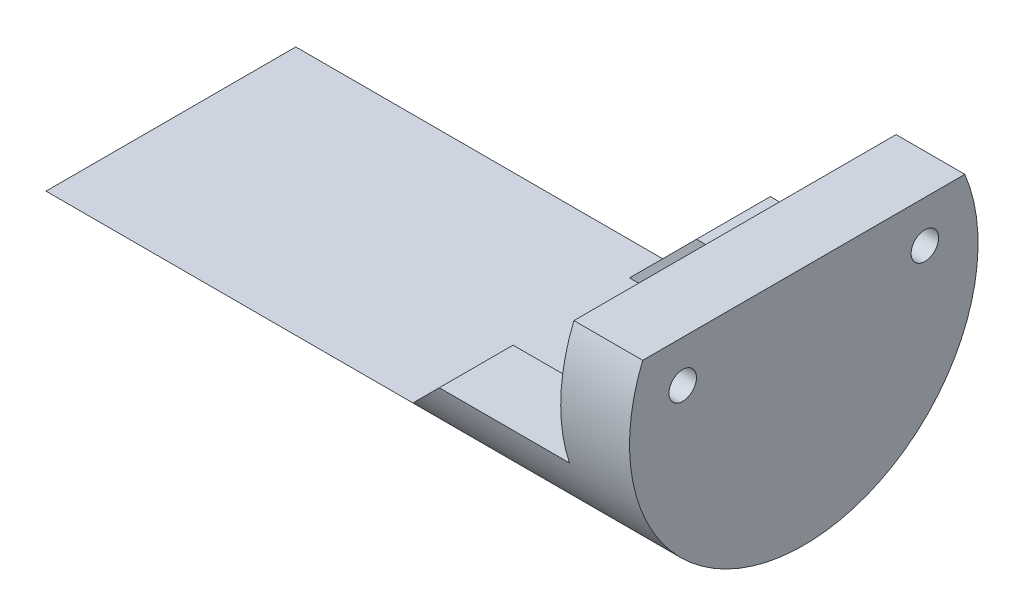
from build123d import *

# Parameters (mm, degrees)
SKETCH_1_R               = 19
EXTRUDE_1_DEPTH          = 69
CUT_EXTRUDE_1_DEPTH      = 75.047282192
CUT_EXTRUDE_1_DEPTH_BACK = 75.047282192
SKETCH_4_W               = 20
SKETCH_4_H               = 14
CUT_EXTRUDE_2_DEPTH      = 68.113709479
SKETCH_5_W               = 20
SKETCH_5_H               = 19.031424338
CUT_EXTRUDE_3_DEPTH      = 6
SKETCH_6_R               = 0.75
CUT_EXTRUDE_4_DEPTH      = 75.047282192
SKETCH_7_R               = 1.5
CUT_EXTRUDE_5_DEPTH      = 6.5


with BuildPart() as part:
    # 草图1 → 凸台-拉伸1 (new body)
    with BuildSketch(Plane(origin=(0, 0, 0), x_dir=(0, 0, -1), z_dir=(1, 0, 0))):
        Circle(SKETCH_1_R)
    extrude(amount=EXTRUDE_1_DEPTH)

    # 草图3 → 切除-拉伸1 (cut, two sides: drawn at the far end of the back side and taken through both)
    with BuildSketch(Plane.XY.offset(-CUT_EXTRUDE_1_DEPTH_BACK)):
        Polygon((69, 7.25), (61.5, 7.25), (61.5, -5.944695841), (47.305304159, -5.944695841), (40, -13.25), (0, -13.25), (0, 41.360608317), (69, 41.360608317), align=None)
    extrude(amount=CUT_EXTRUDE_1_DEPTH + CUT_EXTRUDE_1_DEPTH_BACK, mode=Mode.SUBTRACT)

    # 草图4 → 切除-拉伸2 (cut, through all)
    with BuildSketch(Plane.ZY.offset(-61.5)):
        with Locations((0, -6.25)):
            Rectangle(SKETCH_4_W, SKETCH_4_H)
    extrude(amount=CUT_EXTRUDE_2_DEPTH, mode=Mode.SUBTRACT)

    # 草图5 → 切除-拉伸3 (cut)
    with BuildSketch(Plane.ZY.offset(-61.5)):
        with Locations((0, -3.734287831)):
            Rectangle(SKETCH_5_W, SKETCH_5_H)
    extrude(amount=-CUT_EXTRUDE_3_DEPTH, mode=Mode.SUBTRACT)

    # 草图6 → 切除-拉伸4 (cut, through all)
    with BuildSketch(Plane(origin=(69, 0, 0), x_dir=(0, 0, -1), z_dir=(1, 0, 0))):
        with Locations((-13.2, 2.7)):
            Circle(SKETCH_6_R)
        with Locations((13.2, 2.7)):
            Circle(SKETCH_6_R)
    extrude(amount=-CUT_EXTRUDE_4_DEPTH, mode=Mode.SUBTRACT)

    # 草图7 → 切除-拉伸5 (cut)
    with BuildSketch(Plane(origin=(69, 0, 0), x_dir=(0, 0, -1), z_dir=(1, 0, 0))):
        with Locations((-13.2, 2.7)):
            Circle(SKETCH_7_R)
        with Locations((13.2, 2.7)):
            Circle(SKETCH_7_R)
    extrude(amount=-CUT_EXTRUDE_5_DEPTH, mode=Mode.SUBTRACT)


solid = part.part
